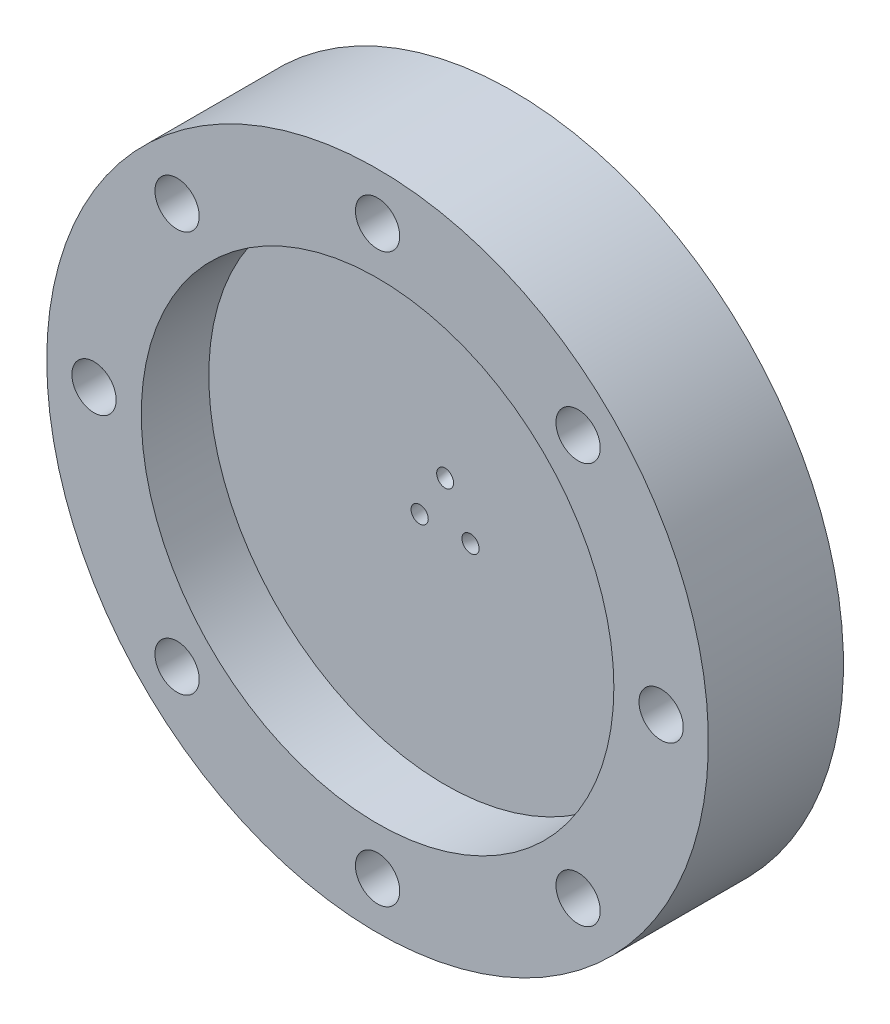
from build123d import *

# Parameters (mm, degrees)
SKETCH2_R           = 31.115
BOSS_EXTRUDE1_DEPTH = 12.7
SKETCH3_R           = 2.0828
CUT_EXTRUDE3_DEPTH  = 12.7
SKETCH4_R           = 22.225
CUT_EXTRUDE2_DEPTH  = 6.35
CUT_EXTRUDE4_REACH  = 49.95
SKETCH8_R           = 0.79375
CIRPATTERN1_COUNT   = 3


with BuildPart() as part:
    # Sketch2 → Boss-Extrude1 (new body)
    with BuildSketch(Plane(origin=(0, 0, -1.71308935), x_dir=(-1, 0, 0), z_dir=(0, 0, -1))):
        Circle(SKETCH2_R)
    extrude(amount=BOSS_EXTRUDE1_DEPTH)

    # Sketch3 → Cut-Extrude3 (cut)
    with BuildSketch(Plane(origin=(0, 0, -14.41308935), x_dir=(-1, 0, 0), z_dir=(0, 0, -1))):
        with Locations((0, 26.67)):
            Circle(SKETCH3_R)
        with Locations((18.858537854, 18.858537854)):
            Circle(SKETCH3_R)
        with Locations((26.67, 0)):
            Circle(SKETCH3_R)
        with Locations((18.858537854, -18.858537854)):
            Circle(SKETCH3_R)
        with Locations((0, -26.67)):
            Circle(SKETCH3_R)
        with Locations((-18.858537854, -18.858537854)):
            Circle(SKETCH3_R)
        with Locations((-26.67, 0)):
            Circle(SKETCH3_R)
        with Locations((-18.858537854, 18.858537854)):
            Circle(SKETCH3_R)
    extrude(amount=-CUT_EXTRUDE3_DEPTH, mode=Mode.SUBTRACT)

    # Sketch4 → Cut-Extrude2 (cut)
    with BuildSketch(Plane.XY.offset(-1.71308935)):
        Circle(SKETCH4_R)
    extrude(amount=-CUT_EXTRUDE2_DEPTH, mode=Mode.SUBTRACT)

    # Sketch6 → Cut-Revolve2 (revolve, cut)
    with BuildSketch(Plane(origin=(0, 0, 0), x_dir=(0, 0, -1), z_dir=(1, 0, 0)), mode=Mode.PRIVATE) as cut_revolve2_sk:
        Polygon((9.96808935, 0), (9.96808935, 6.35), (12.50808935, 6.35), (12.50808935, 2.0828), (14.41308935, 2.0828), (14.41308935, 0), align=None)
    revolve(cut_revolve2_sk.sketch.rotate(Axis((0, 0, 69.036833432), (0, 0, -1)), 90), axis=Axis((0, 0, 69.036833432), (0, 0, -1)), mode=Mode.SUBTRACT)

    # Cut-Extrude4: up to this plane
    cut_extrude4_end = Plane(origin=(0, 0, -9.96808935), z_dir=(0, 0, -1))
    # Sketch8 → Cut-Extrude4 (cut, up to the surface)
    with BuildSketch(Plane(origin=(0, 0, 4.63691065), x_dir=(1, 0, 0), z_dir=(0, -0.21242964433104367, 0.9771763639228009)), mode=Mode.PRIVATE) as cut_extrude4_sk1:
        with Locations(Location((0, 0, 0), (0, 0, 270))):
            Circle(SKETCH8_R)
    cut_extrude4_tool1 = split(extrude(cut_extrude4_sk1.sketch, amount=-CUT_EXTRUDE4_REACH, mode=Mode.PRIVATE), bisect_by=cut_extrude4_end, keep=Keep.BOTH, mode=Mode.PRIVATE)
    cut_extrude4 = cut_extrude4_tool1.solids().sort_by_distance((0, 0, 4.636911))[0]
    add(cut_extrude4, mode=Mode.SUBTRACT)

    # CirPattern1: Cut-Extrude4 ×3 about axis
    cirpattern1_axis = Axis((0, 0, -1.71308935), (0, 0, 1))
    for i in range(1, CIRPATTERN1_COUNT):
        add(cut_extrude4.rotate(cirpattern1_axis, i * 360 / CIRPATTERN1_COUNT), mode=Mode.SUBTRACT)


solid = part.part
